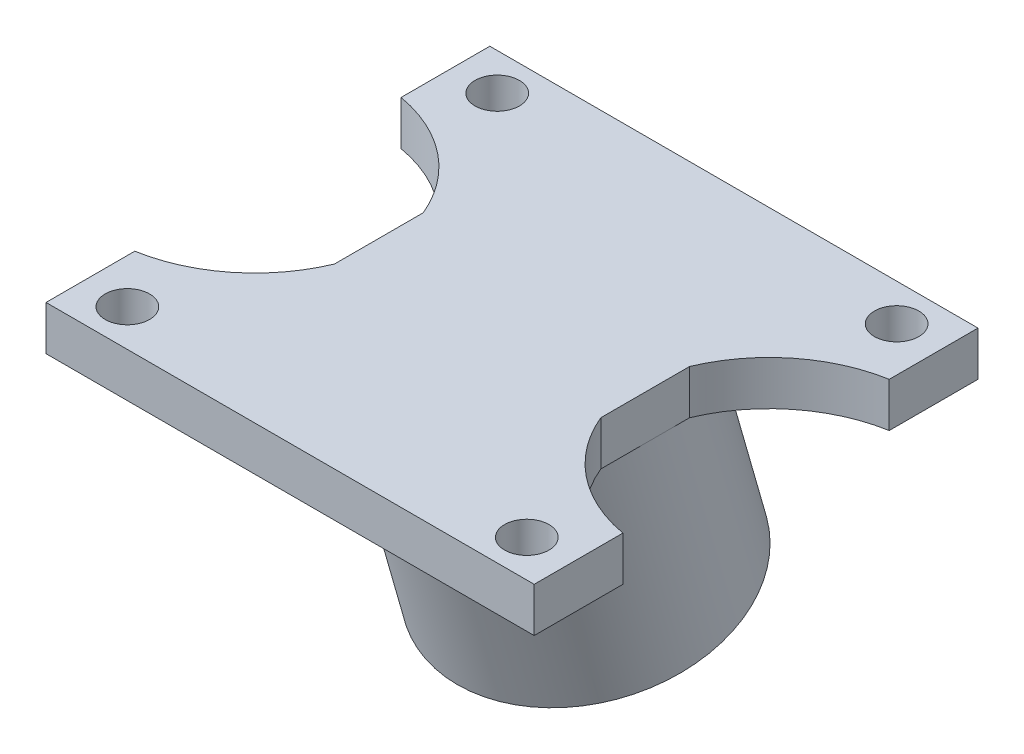
from build123d import *

# Parameters (mm, degrees)
SKETCH_1_R          = 1.5
EXTRUDE_1_DEPTH     = 3
SKETCH_3_R          = 9
SKETCH_3_R_2        = 8
EXTRUDE_2_DEPTH     = 18
SKETCH_4_W          = 18
SKETCH_4_H          = 2.480736202
CUT_EXTRUDE_1_DEPTH = 30


with BuildPart() as part:
    # 草图1 → 凸台-拉伸1 (new body)
    with BuildSketch(Plane(origin=(0, 0, 0), x_dir=(1, 0, 0), z_dir=(0, 1, 0))):
        with BuildLine():
            Line((-16.5, 15), (16.5, 15))
            Line((16.5, 15), (16.5, 9))
            ThreePointArc((16.5, 9), (11.982501162, 6.959373548), (9, 3))
            Line((9, 3), (9, -3))
            ThreePointArc((9, -3), (11.982501162, -6.959373548), (16.5, -9))
            Line((16.5, -9), (16.5, -15))
            Line((16.5, -15), (-16.5, -15))
            Line((-16.5, -15), (-16.5, -9))
            ThreePointArc((-16.5, -9), (-11.982501162, -6.959373548), (-9, -3))
            Line((-9, -3), (-9, 3))
            ThreePointArc((-9, 3), (-11.982501162, 6.959373548), (-16.5, 9))
            Line((-16.5, 9), (-16.5, 15))
        make_face()
        with Locations(Location((-13.5, 12.5, 0), (0, 0, 270))):
            Circle(SKETCH_1_R, mode=Mode.SUBTRACT)
        with Locations(Location((13.5, 12.5, 0), (0, 0, 270))):
            Circle(SKETCH_1_R, mode=Mode.SUBTRACT)
        with Locations(Location((13.5, -12.5, 0), (0, 0, 270))):
            Circle(SKETCH_1_R, mode=Mode.SUBTRACT)
        with Locations(Location((-13.5, -12.5, 0), (0, 0, 270))):
            Circle(SKETCH_1_R, mode=Mode.SUBTRACT)
    extrude(amount=EXTRUDE_1_DEPTH)

    # 草图3 → 凸台-拉伸2 (add)
    with BuildSketch(Plane(origin=(0, 2.772072144, 0.794878896), x_dir=(1, 0, 0), z_dir=(0, 0.9612616959383188, 0.27563735581699983))):
        with Locations(Location((0, 0.826912067, 0), (0, 0, 270))):
            Circle(SKETCH_3_R)
        with Locations(Location((0, 0.826912067, 0), (0, 0, 270))):
            Circle(SKETCH_3_R_2, mode=Mode.SUBTRACT)
    extrude(amount=-EXTRUDE_2_DEPTH)

    # 草图4 → 切除-拉伸1 (cut)
    with BuildSketch(Plane.XY.offset(15)):
        with Locations((0, 4.240368101)):
            Rectangle(SKETCH_4_W, SKETCH_4_H)
    extrude(amount=-CUT_EXTRUDE_1_DEPTH, mode=Mode.SUBTRACT)


solid = part.part
